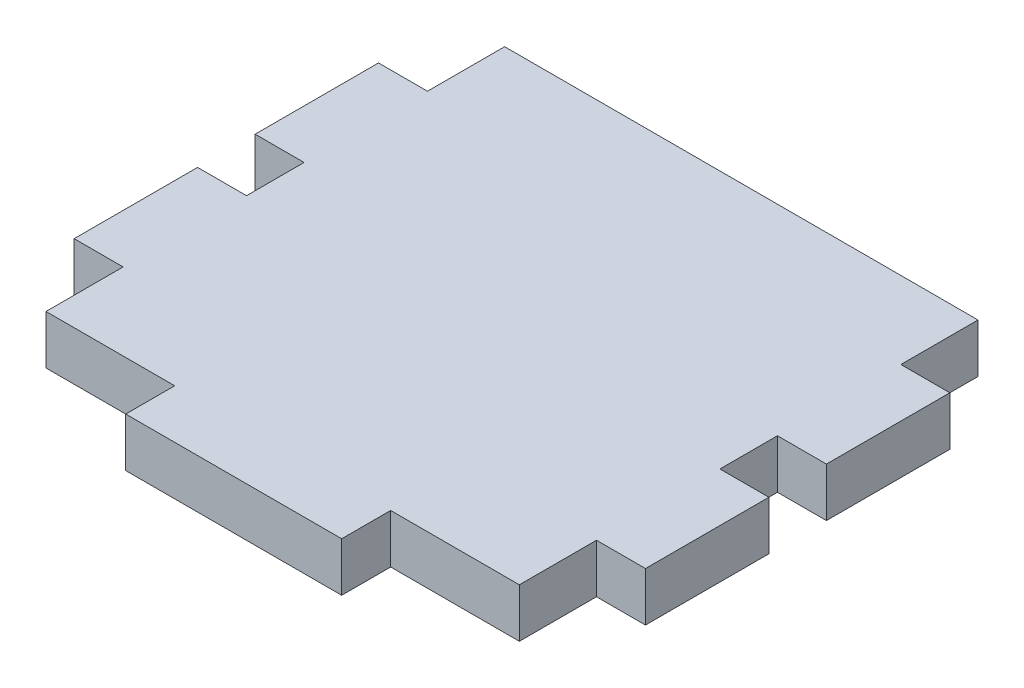
from build123d import *

# Parameters (mm, degrees)
SKETCH1_W           = 3.175
SKETCH1_H           = 8
SKETCH1_W_2         = 30.6846
SKETCH1_H_2         = 29.73
BOSS_EXTRUDE1_DEPTH = 3.175
SKETCH2_W           = 14
SKETCH2_H           = 3.175
BOSS_EXTRUDE5_DEPTH = 3.175


with BuildPart() as part:
    # Sketch1 → Boss-Extrude1 (new body)
    with BuildSketch(Plane(origin=(0, 0, 0), x_dir=(1, 0, 0), z_dir=(0, 1, 0))):
        with Locations((-16.9298, 5.865)):
            Rectangle(SKETCH1_W, SKETCH1_H)
        Rectangle(SKETCH1_W_2, SKETCH1_H_2)
        with Locations((16.9298, -5.865)):
            Rectangle(SKETCH1_W, SKETCH1_H)
        with Locations((16.9298, 5.865)):
            Rectangle(SKETCH1_W, SKETCH1_H)
        with Locations((-16.9298, -5.865)):
            Rectangle(SKETCH1_W, SKETCH1_H)
    extrude(amount=BOSS_EXTRUDE1_DEPTH)

    # Sketch2 → Boss-Extrude5 (add)
    with BuildSketch(Plane.XY.offset(14.865)):
        with Locations((0, 1.5875)):
            Rectangle(SKETCH2_W, SKETCH2_H)
    extrude(amount=BOSS_EXTRUDE5_DEPTH)


solid = part.part
